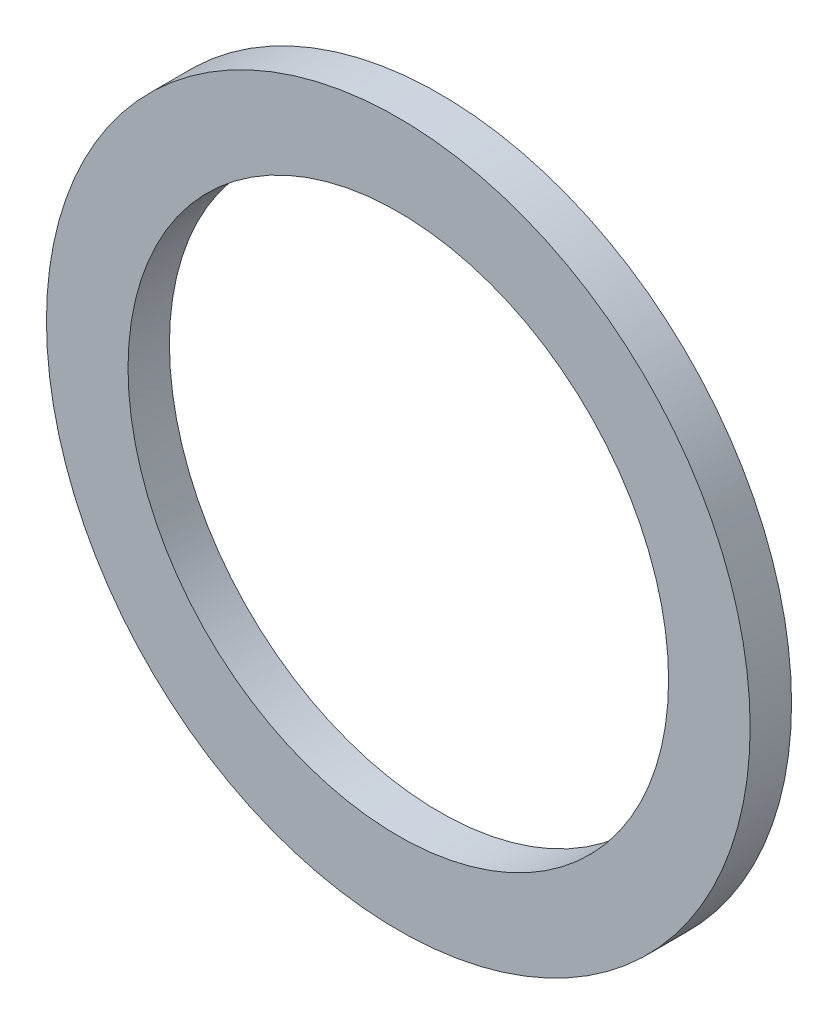
from build123d import *

# Parameters (mm, degrees)
SKETCH1_R      = 14.45
SKETCH1_R_2    = 11.1
EXTRUDE1_DEPTH = 1.7


with BuildPart() as part:
    # Sketch1 → Extrude1 (new body)
    with BuildSketch(Plane.XY):
        Circle(SKETCH1_R)
        Circle(SKETCH1_R_2, mode=Mode.SUBTRACT)
    extrude(amount=-EXTRUDE1_DEPTH)


solid = part.part
